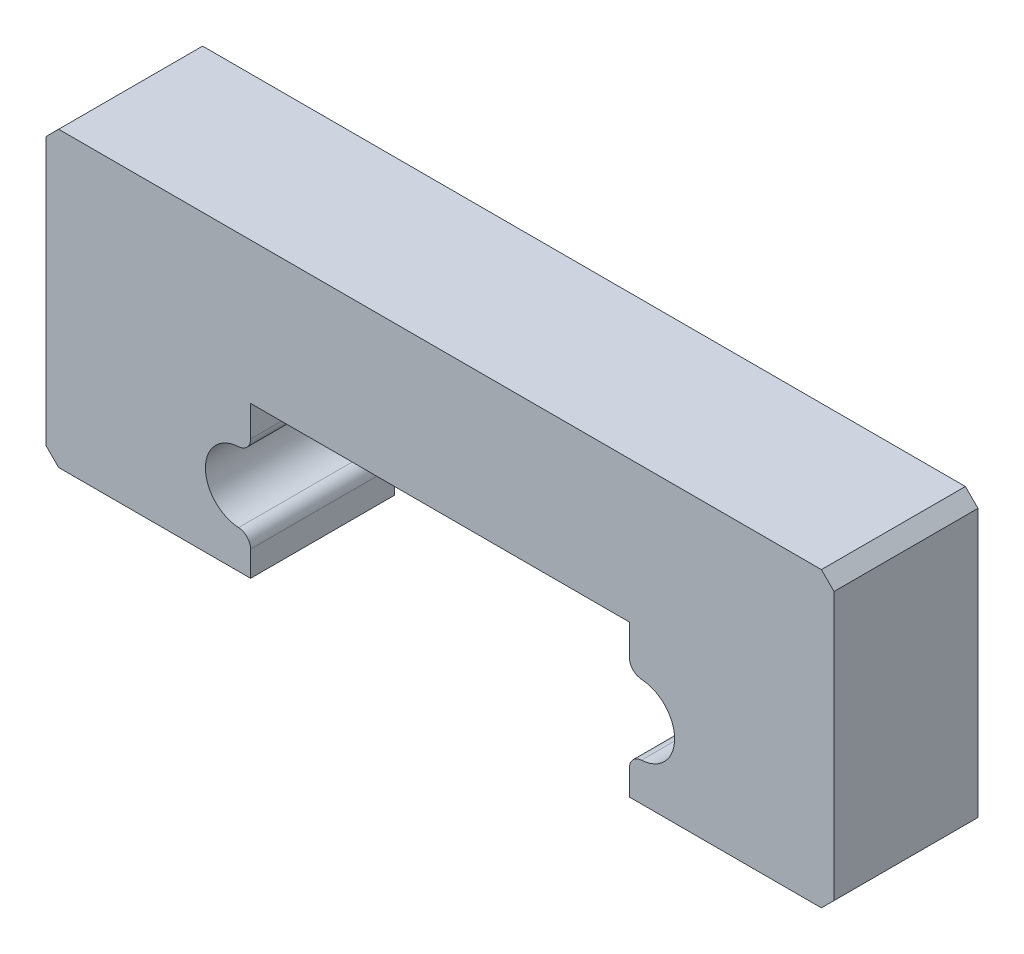
from build123d import *

# Parameters (mm, degrees)
BOSS_EXTRUDE1_DEPTH = 5.7
FILLET1_R           = 0.5


with BuildPart() as part:
    # Sketch1 → Boss-Extrude1 (new body)
    with BuildSketch(Plane.XY):
        with BuildLine():
            Line((7.5, -1.579841739), (7.5, 0.2))
            Line((7.5, 0.2), (-7.5, 0.2))
            Line((-7.5, 0.2), (-7.5, -1.579841739))
            ThreePointArc((-7.5, -1.579841739), (-9.289, -2.91), (-7.5, -4.240158261))
            Line((-7.5, -4.240158261), (-7.5, -5.8))
            Line((-7.5, -5.8), (-15.1, -5.8))
            Line((-15.1, -5.8), (-15.6, -5.3))
            Line((-15.6, -5.3), (-15.6, 5.3))
            Line((-15.6, 5.3), (-15.1, 5.8))
            Line((-15.1, 5.8), (15.1, 5.8))
            Line((15.1, 5.8), (15.6, 5.3))
            Line((15.6, 5.3), (15.6, -5.3))
            Line((15.6, -5.3), (15.1, -5.8))
            Line((15.1, -5.8), (7.5, -5.8))
            Line((7.5, -5.8), (7.5, -4.240158261))
            ThreePointArc((7.5, -4.240158261), (9.289, -2.91), (7.5, -1.579841739))
        make_face()
    extrude(amount=-BOSS_EXTRUDE1_DEPTH)

    # Fillet1
    fillet1_edges = [part.edges().sort_by_distance(p)[0] for p in [
        (-7.5, -1.579841739, -2.85),
        (-7.5, -4.240158261, -2.85),
        (7.5, -4.240158261, -2.85),
        (7.5, -1.579841739, -2.85),
    ]]
    fillet(fillet1_edges, radius=FILLET1_R)


solid = part.part
